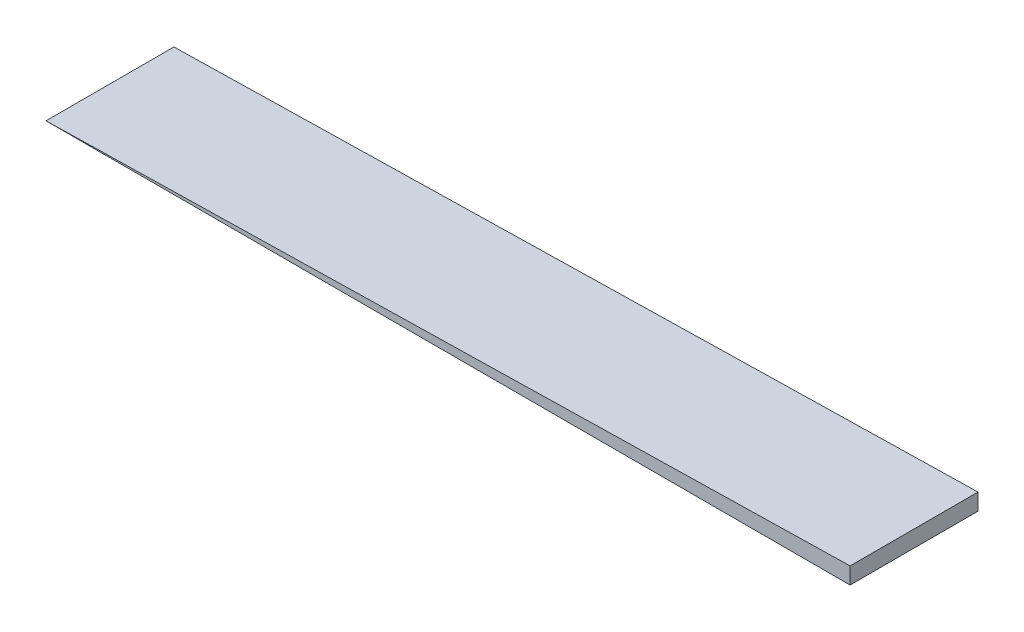
from build123d import *

# Parameters (mm, degrees)
BOSS_EXTRUDE1_DEPTH = 44.45


with BuildPart() as part:
    # Sketch1 → Boss-Extrude1 (new, symmetric)
    with BuildSketch(Plane.XY):
        Polygon((0, 0), (558.8, 0), (558.8, 11.519806249), align=None)
    extrude(amount=BOSS_EXTRUDE1_DEPTH, both=True)


solid = part.part
